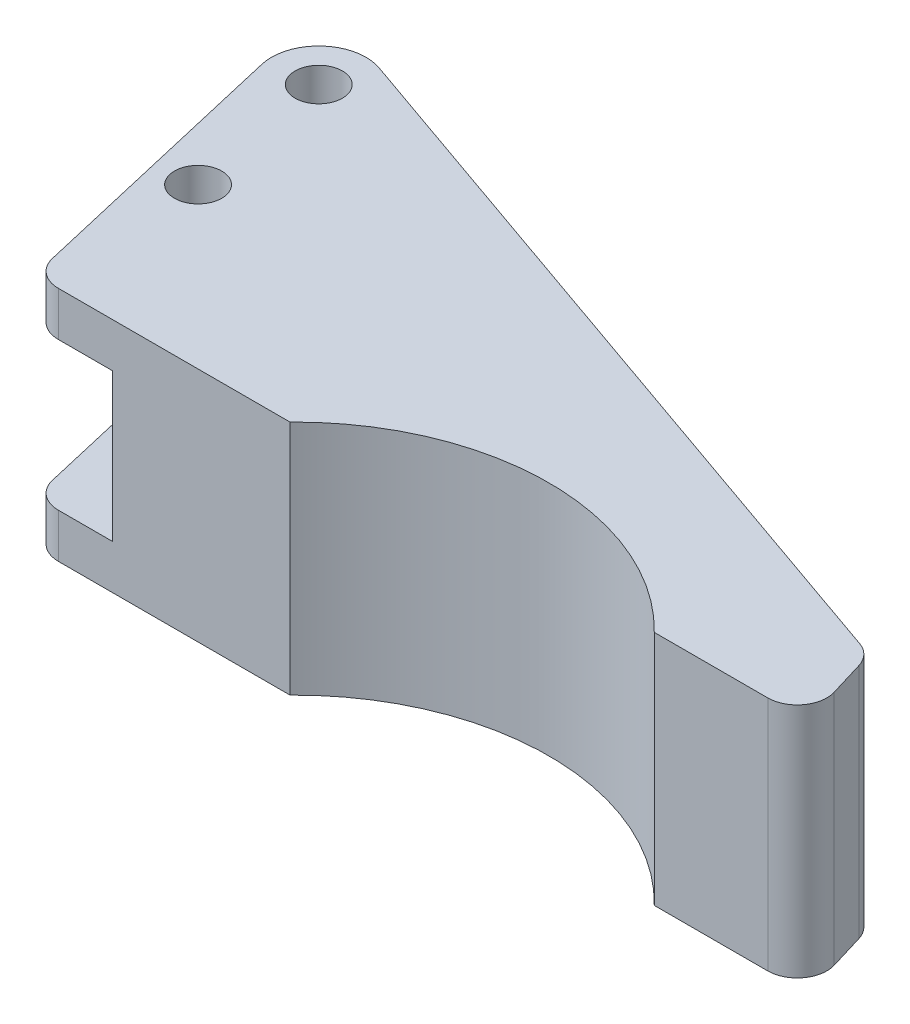
from build123d import *

# Parameters (mm, degrees)
SKETCH2_R           = 4
BOSS_EXTRUDE1_DEPTH = 20
SKETCH3_W           = 25
SKETCH3_H           = 25
CUT_EXTRUDE1_DEPTH  = 107.529597523


with BuildPart() as part:
    # Sketch2 → Boss-Extrude1 (new, symmetric)
    with BuildSketch(Plane(origin=(0, 0, 0), x_dir=(1, 0, 0), z_dir=(0, 1, 0))):
        with BuildLine():
            Line((-30.805843601, 0), (-70, 0))
            ThreePointArc((-70, 0), (-73.109650812, 1.084636437), (-74.870165393, 3.867971269))
            Line((-74.870165393, 3.867971269), (-85.606821951, 50.05875403))
            ThreePointArc((-85.606821951, 50.05875403), (-83.158089611, 57.823709992), (-75.174557322, 59.421847456))
            Line((-75.174557322, 59.421847456), (49.836959924, 15.71990466))
            ThreePointArc((49.836959924, 15.71990466), (51.797432477, 14.458972094), (52.973218852, 12.446279875))
            Line((52.973218852, 12.446279875), (54.786258928, 6.446279875))
            ThreePointArc((54.786258928, 6.446279875), (54.01443641, 2.019345657), (50, 0))
            Line((50, 0), (30.805843601, 0))
            ThreePointArc((30.805843601, 0), (0, 13), (-30.805843601, 0))
        make_face()
        with Locations(Location((-77.814557322, 51.87, 0), (0, 0, 270))):
            Circle(SKETCH2_R, mode=Mode.SUBTRACT)
        with Locations(Location((-73.36, 27, 0), (0, 0, 270))):
            Circle(SKETCH2_R, mode=Mode.SUBTRACT)
    extrude(amount=BOSS_EXTRUDE1_DEPTH, both=True)

    # Sketch3 → Cut-Extrude1 (cut, through all)
    with BuildSketch(Plane.XY):
        with Locations((-73.314557322, 0)):
            Rectangle(SKETCH3_W, SKETCH3_H)
    extrude(amount=-CUT_EXTRUDE1_DEPTH, mode=Mode.SUBTRACT)


solid = part.part
